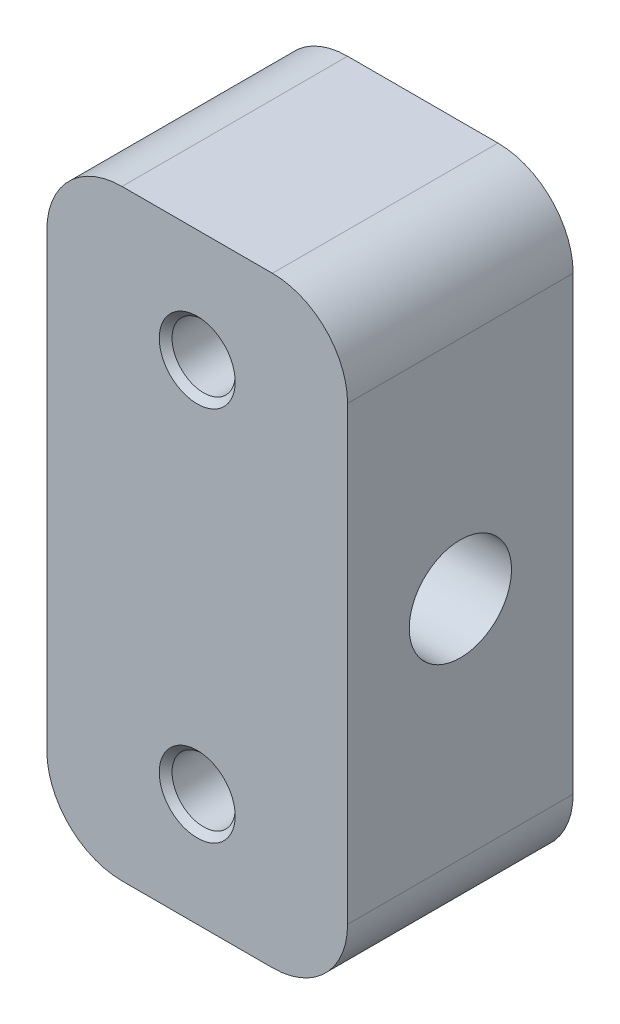
from build123d import *

# Parameters (mm, degrees)
SKETCH1_W                   = 20
SKETCH1_H                   = 40
BOSS_EXTRUDE1_DEPTH         = 7.5
FILLET1_R                   = 5
M5_TAPPED_HOLE1_D           = 4.2
M5_TAPPED_HOLE1_CSINK_D     = 5.05
M5_TAPPED_HOLE1_CSINK_ANGLE = 90
M8_TAPPED_HOLE1_D           = 6.8
M8_TAPPED_HOLE1_DEPTH       = 20
M8_TAPPED_HOLE1_CSINK_D     = 8.05
M8_TAPPED_HOLE1_CSINK_ANGLE = 90
M8_TAPPED_HOLE1_TIP         = 2.042926105


with BuildPart() as part:
    # Sketch1 → Boss-Extrude1 (new, symmetric)
    with BuildSketch(Plane.XY):
        Rectangle(SKETCH1_W, SKETCH1_H)
    extrude(amount=BOSS_EXTRUDE1_DEPTH, both=True)

    # Fillet1
    fillet1_edges = [part.edges().sort_by_distance(p)[0] for p in [
        (10, -20, 0),
        (-10, -20, 0),
        (-10, 20, 0),
        (10, 20, 0),
    ]]
    fillet(fillet1_edges, radius=FILLET1_R)

    # M5 Tapped Hole1 (through all)
    with Locations(Plane.XY.offset(7.5)):
        with Locations((0, 12.5), (0, -12.5)):
            CounterSinkHole(M5_TAPPED_HOLE1_D / 2, M5_TAPPED_HOLE1_CSINK_D / 2, counter_sink_angle=M5_TAPPED_HOLE1_CSINK_ANGLE)

    # M8 Tapped Hole1
    with Locations(Plane.ZY.offset(10)):
        with Locations((0, 0)):
            CounterSinkHole(M8_TAPPED_HOLE1_D / 2, M8_TAPPED_HOLE1_CSINK_D / 2, depth=M8_TAPPED_HOLE1_DEPTH, counter_sink_angle=M8_TAPPED_HOLE1_CSINK_ANGLE)
            with Locations((0, 0, -(M8_TAPPED_HOLE1_DEPTH + M8_TAPPED_HOLE1_TIP / 2))):  # 118° drill point
                Cone(0, M8_TAPPED_HOLE1_D / 2, M8_TAPPED_HOLE1_TIP, mode=Mode.SUBTRACT)


solid = part.part
